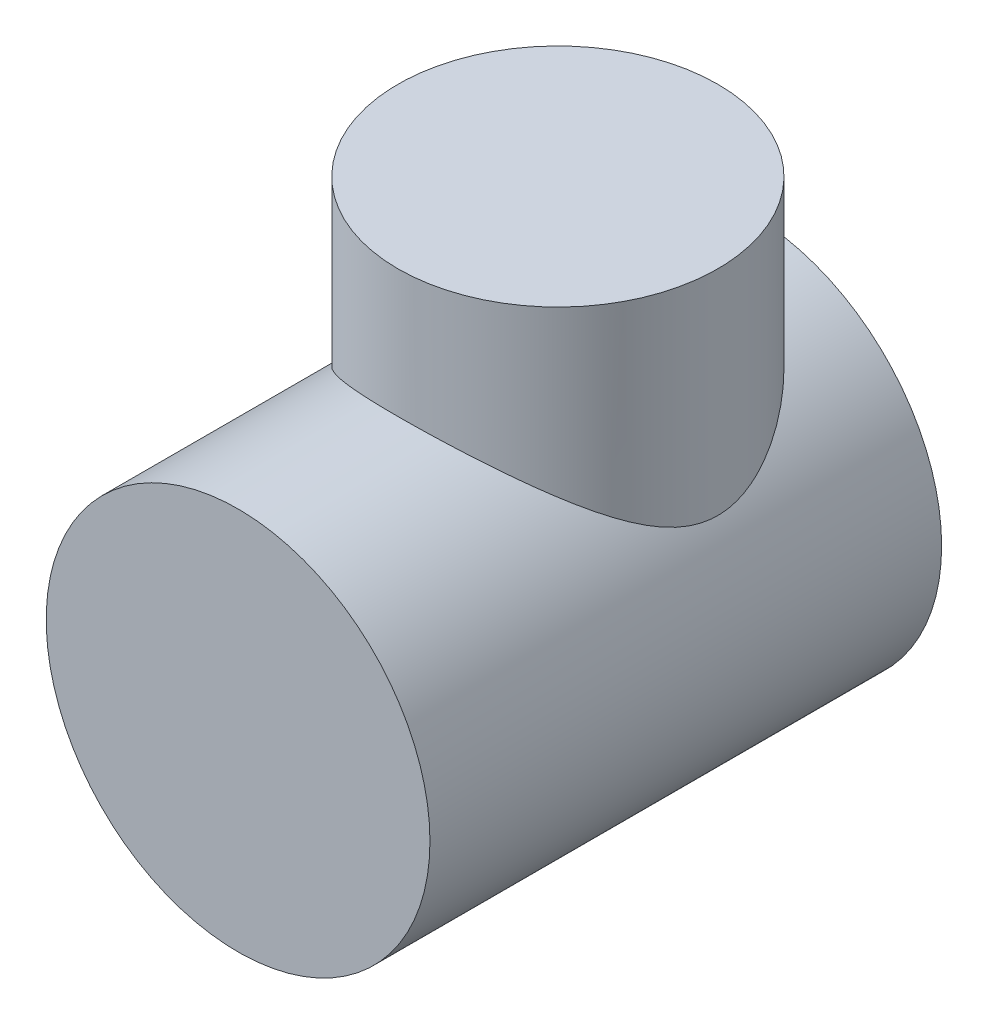
from build123d import *

# Parameters (mm, degrees)
SKETCH_1_R      = 300
EXTRUDE_1_DEPTH = 800
SKETCH_2_R      = 250
EXTRUDE_2_DEPTH = 500


with BuildPart() as part:
    # 草图1 → 凸台-拉伸1 (new body)
    with BuildSketch(Plane.XY):
        Circle(SKETCH_1_R)
    extrude(amount=EXTRUDE_1_DEPTH)

    # 草图2 → 凸台-拉伸2 (add)
    with BuildSketch(Plane(origin=(0, 0, 0), x_dir=(1, 0, 0), z_dir=(0, 1, 0))):
        with Locations((0, -300)):
            Circle(SKETCH_2_R)
    extrude(amount=EXTRUDE_2_DEPTH)


solid = part.part
